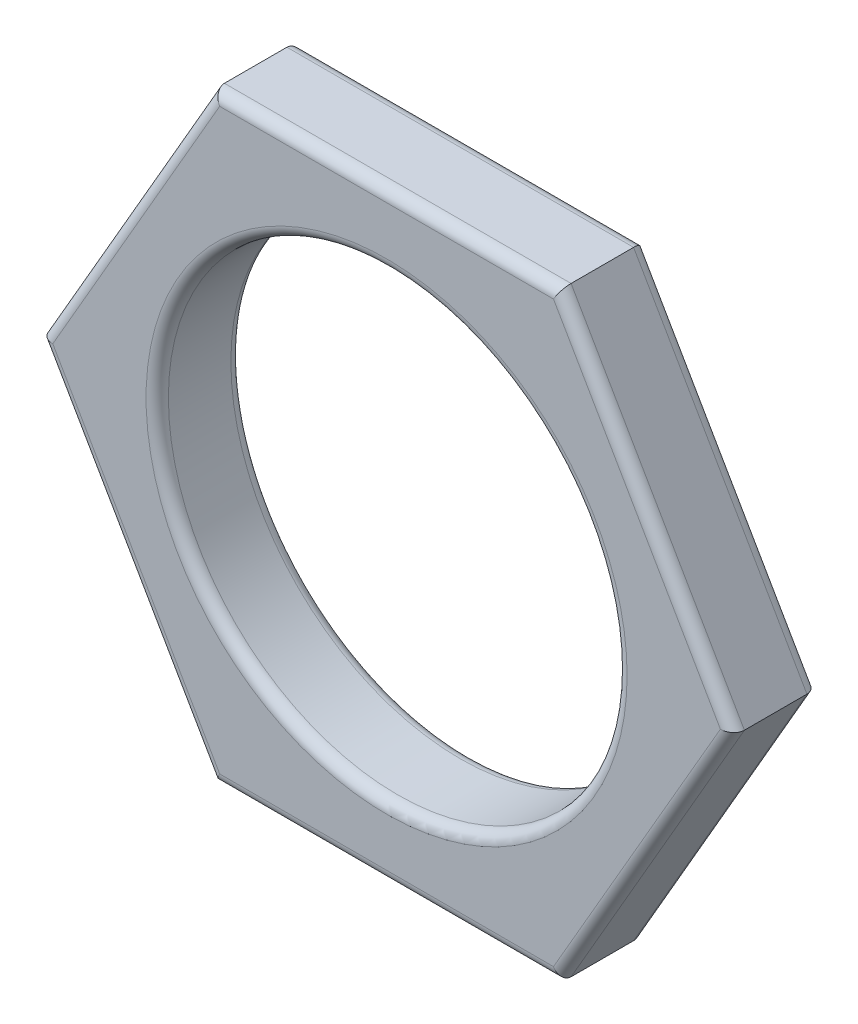
from build123d import *

# Parameters (mm, degrees)
SCHIZZO1_R                   = 10.275
ESTRUSIONE_ESTRUSIONE1_DEPTH = 1.9
RACCORDO1_R                  = 0.5


with BuildPart() as part:
    # Schizzo1 → Estrusione-Estrusione1 (new, symmetric)
    with BuildSketch(Plane.XY):
        Polygon((-15.530722241, 0), (-7.765361121, -13.45), (7.765361121, -13.45), (15.530722241, 0), (7.765361121, 13.45), (-7.765361121, 13.45), align=None)
        with Locations(Location((0, 0, 0), (0, 0, 180))):
            Circle(SCHIZZO1_R, mode=Mode.SUBTRACT)
    extrude(amount=ESTRUSIONE_ESTRUSIONE1_DEPTH, both=True)

    # Raccordo1
    raccordo1_edges = [part.edges().sort_by_distance(p)[0] for p in [
        (0, -13.45, 1.9),
        (11.648041681, -6.725, 1.9),
        (11.648041681, 6.725, 1.9),
        (10.275, 0, -1.9),
        (10.275, 0, 1.9),
        (0, 13.45, 1.9),
        (-11.648041681, 6.725, 1.9),
        (0, 13.45, -1.9),
        (11.648041681, 6.725, -1.9),
        (11.648041681, -6.725, -1.9),
        (-11.648041681, -6.725, 1.9),
        (0, -13.45, -1.9),
        (-11.648041681, -6.725, -1.9),
        (-11.648041681, 6.725, -1.9),
    ]]
    fillet(raccordo1_edges, radius=RACCORDO1_R)


solid = part.part
